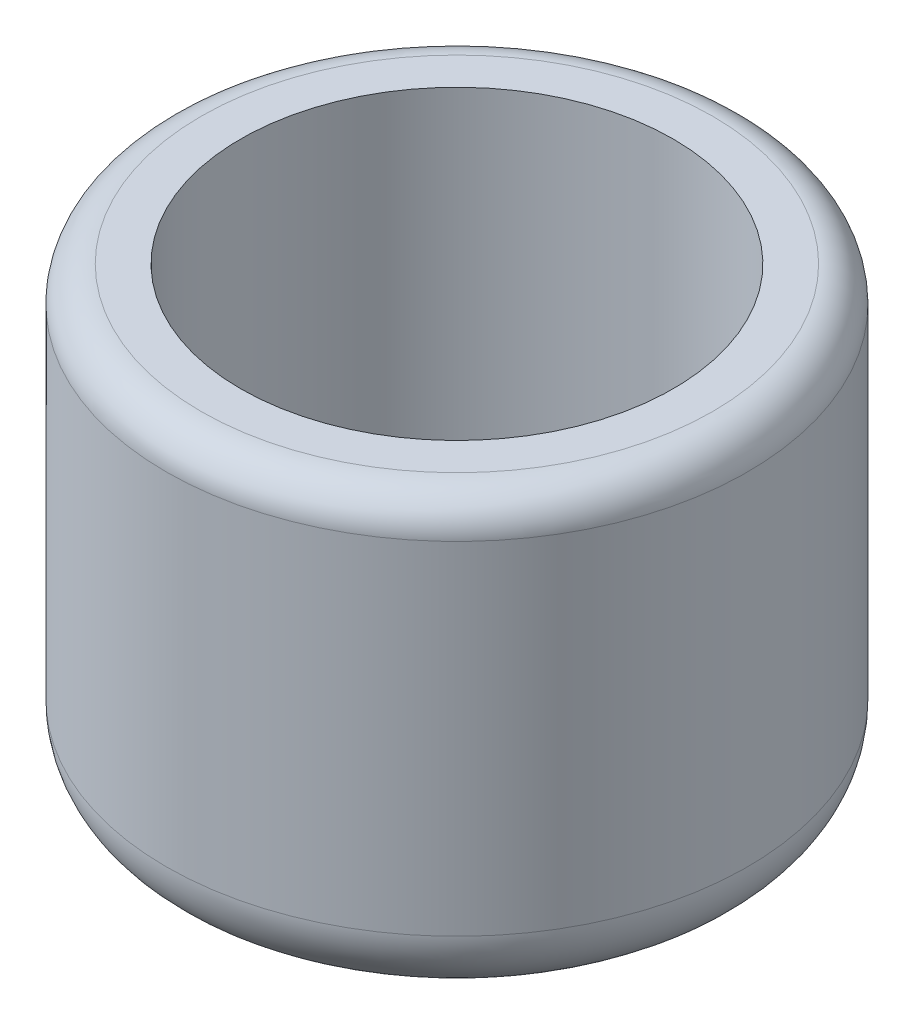
from build123d import *

# Parameters (mm, degrees)
SKETCH1_R           = 10.5791
BOSS_EXTRUDE1_DEPTH = 16.256
SKETCH2_R           = 7.874
CUT_EXTRUDE1_DEPTH  = 13.97
FILLET1_R           = 1.27
FILLET2_R           = 2.54
SKETCH4_R           = 1.143
CUT_EXTRUDE2_DEPTH  = 21.469382398


with BuildPart() as part:
    # Sketch1 → Boss-Extrude1 (new body)
    with BuildSketch(Plane(origin=(0, 0, 0), x_dir=(1, 0, 0), z_dir=(0, 1, 0))):
        with Locations(Location((0, 0, 0), (0, 0, 270))):
            Circle(SKETCH1_R)
    extrude(amount=BOSS_EXTRUDE1_DEPTH)

    # Sketch2 → Cut-Extrude1 (cut)
    with BuildSketch(Plane(origin=(0, 16.256, 0), x_dir=(1, 0, 0), z_dir=(0, 1, 0))):
        with Locations(Location((0, 0, 0), (0, 0, 270))):
            Circle(SKETCH2_R)
    extrude(amount=-CUT_EXTRUDE1_DEPTH, mode=Mode.SUBTRACT)

    # Fillet1
    fillet1_edges = [part.edges().sort_by_distance(p)[0] for p in [
        (0, 16.256, -10.5791),
    ]]
    fillet(fillet1_edges, radius=FILLET1_R)

    # Fillet2
    fillet2_edges = [part.edges().sort_by_distance(p)[0] for p in [
        (0, 0, -10.5791),
    ]]
    fillet(fillet2_edges, radius=FILLET2_R)

    # Sketch4 → Cut-Extrude2 (cut, through all)
    with BuildSketch(Plane(origin=(0, 2.286, 0), x_dir=(1, 0, 0), z_dir=(0, 1, 0))):
        with Locations(Location((0, 0, 0), (0, 0, 270))):
            Circle(SKETCH4_R)
    extrude(amount=-CUT_EXTRUDE2_DEPTH, mode=Mode.SUBTRACT)


solid = part.part
